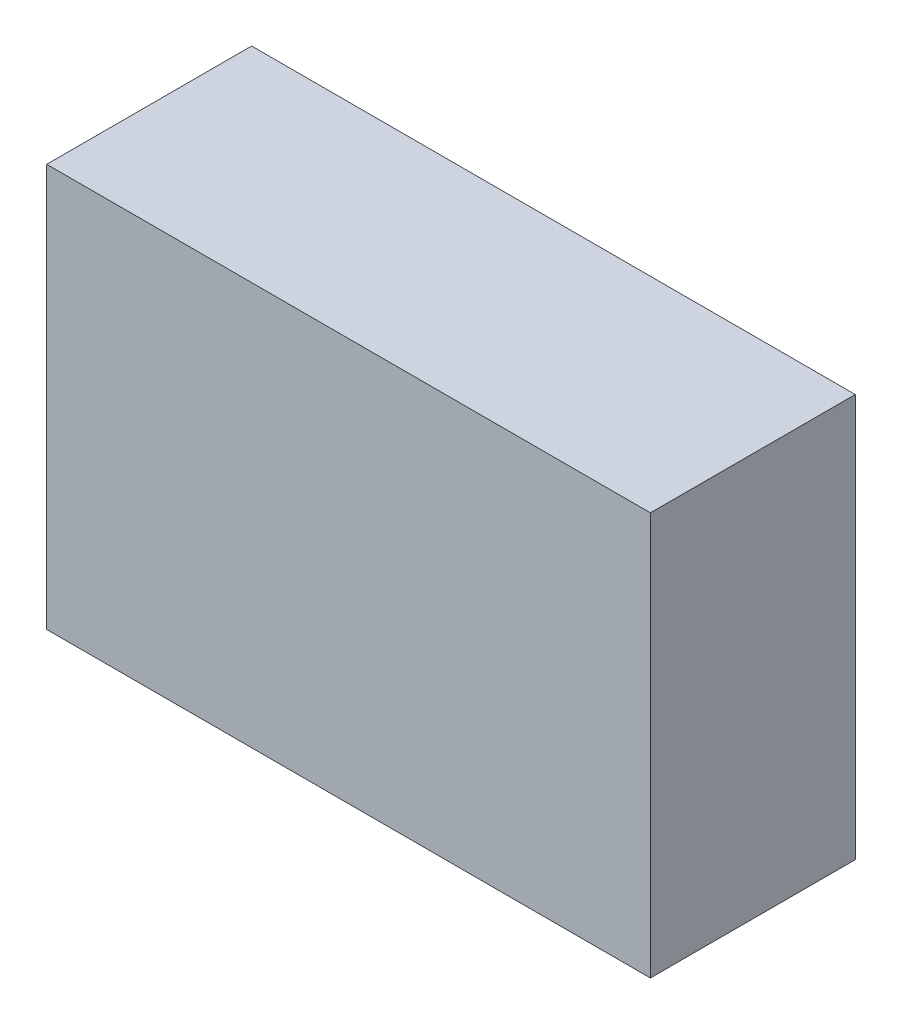
from build123d import *

# Parameters (mm, degrees)
SKETCH1_W               = 2.946
SKETCH1_H               = 1.966
COMPONENT_OUTLINE_DEPTH = 1


with BuildPart() as part:
    # Sketch1 → Component_Outline (new body)
    with BuildSketch(Plane.XY):
        Rectangle(SKETCH1_W, SKETCH1_H)
    extrude(amount=COMPONENT_OUTLINE_DEPTH)


solid = part.part
